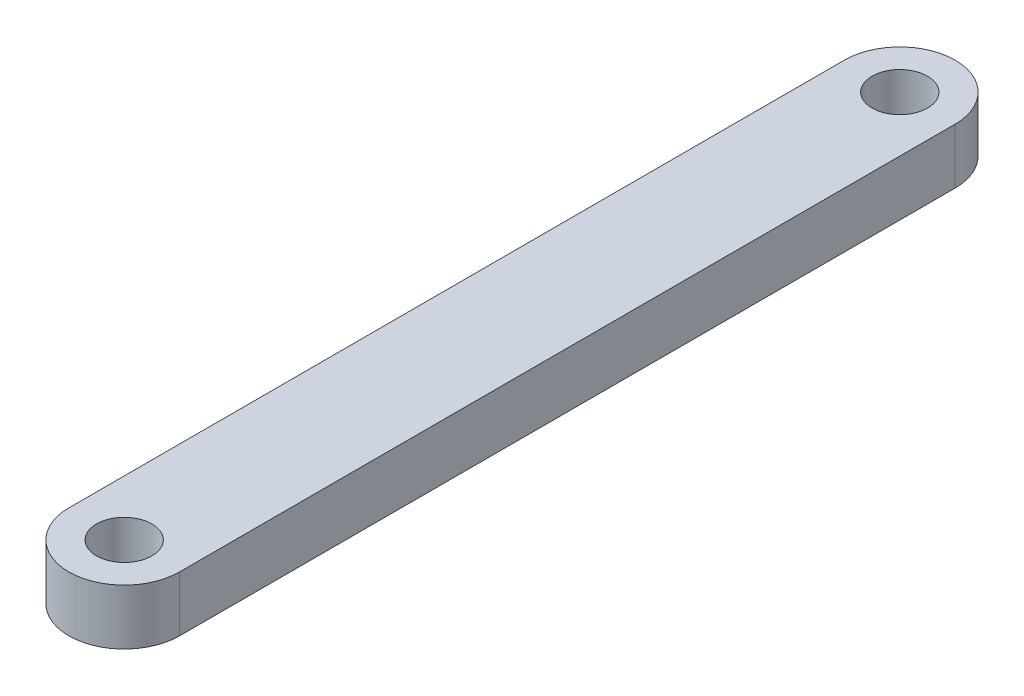
from build123d import *

# Parameters (mm, degrees)
CROQUIS1_R              = 2.5
SALIENTE_EXTRUIR1_DEPTH = 5


with BuildPart() as part:
    # Croquis1 → Saliente-Extruir1 (new body)
    with BuildSketch(Plane(origin=(0, 0, 0), x_dir=(1, 0, 0), z_dir=(0, 1, 0))):
        with BuildLine():
            Line((-5, 70), (-5, 0))
            ThreePointArc((-5, 0), (0, -5), (5, 0))
            Line((5, 0), (5, 70))
            ThreePointArc((5, 70), (0, 75), (-5, 70))
        make_face()
        with Locations(Location((0, 0, 0), (0, 0, 270))):
            Circle(CROQUIS1_R, mode=Mode.SUBTRACT)
        with Locations(Location((0, 70, 0), (0, 0, 270))):
            Circle(CROQUIS1_R, mode=Mode.SUBTRACT)
    extrude(amount=SALIENTE_EXTRUIR1_DEPTH)


solid = part.part
